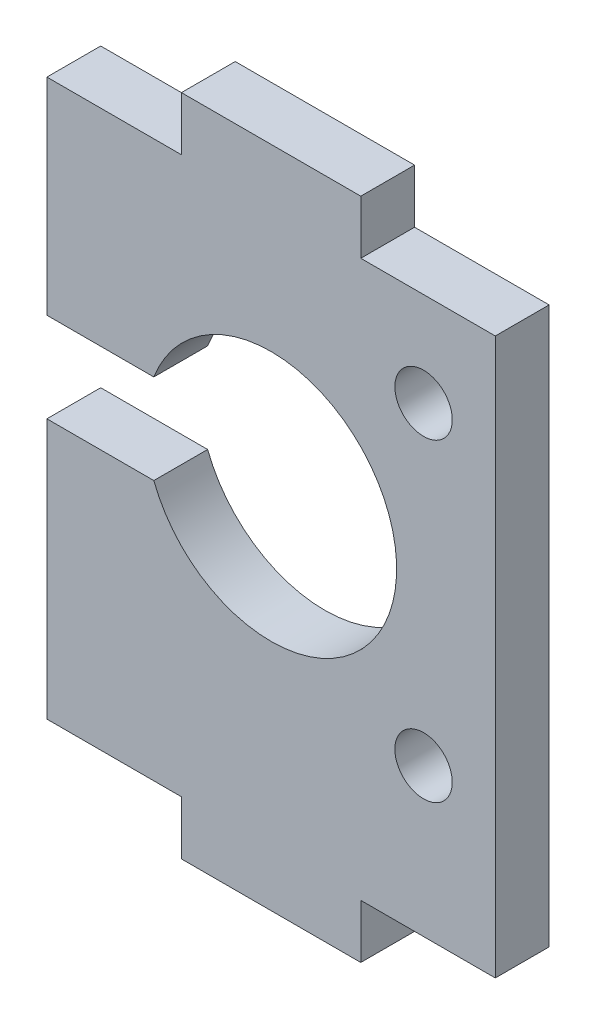
from build123d import *

# Parameters (mm, degrees)
SKETCH1_R           = 1.6
BOSS_EXTRUDE1_DEPTH = 3


with BuildPart() as part:
    # Sketch1 → Boss-Extrude1 (new body)
    with BuildSketch(Plane(origin=(0, 0, 0), x_dir=(1, 0, 0), z_dir=(0, 0, -1))):
        with BuildLine():
            Line((-5, 17), (-5, 20))
            Line((-5, 20), (5, 20))
            Line((5, 20), (5, 17))
            Line((5, 17), (12.5, 17))
            Line((12.5, 17), (12.5, -14))
            Line((12.5, -14), (5, -14))
            Line((5, -14), (5, -17))
            Line((5, -17), (-5, -17))
            Line((-5, -17), (-5, -14))
            Line((-5, -14), (-12.5, -14))
            Line((-12.5, -14), (-12.5, -2.5))
            Line((-12.5, -2.5), (-6.538348415, -2.5))
            ThreePointArc((-6.538348415, -2.5), (7, 0), (-6.538348415, 2.5))
            Line((-6.538348415, 2.5), (-12.5, 2.5))
            Line((-12.5, 2.5), (-12.5, 17))
            Line((-12.5, 17), (-5, 17))
        make_face()
        with Locations(Location((8.5, 8.75, 0), (0, 0, 180))):
            Circle(SKETCH1_R, mode=Mode.SUBTRACT)
        with Locations((8.5, -8.75)):
            Circle(SKETCH1_R, mode=Mode.SUBTRACT)
    extrude(amount=BOSS_EXTRUDE1_DEPTH)


solid = part.part
